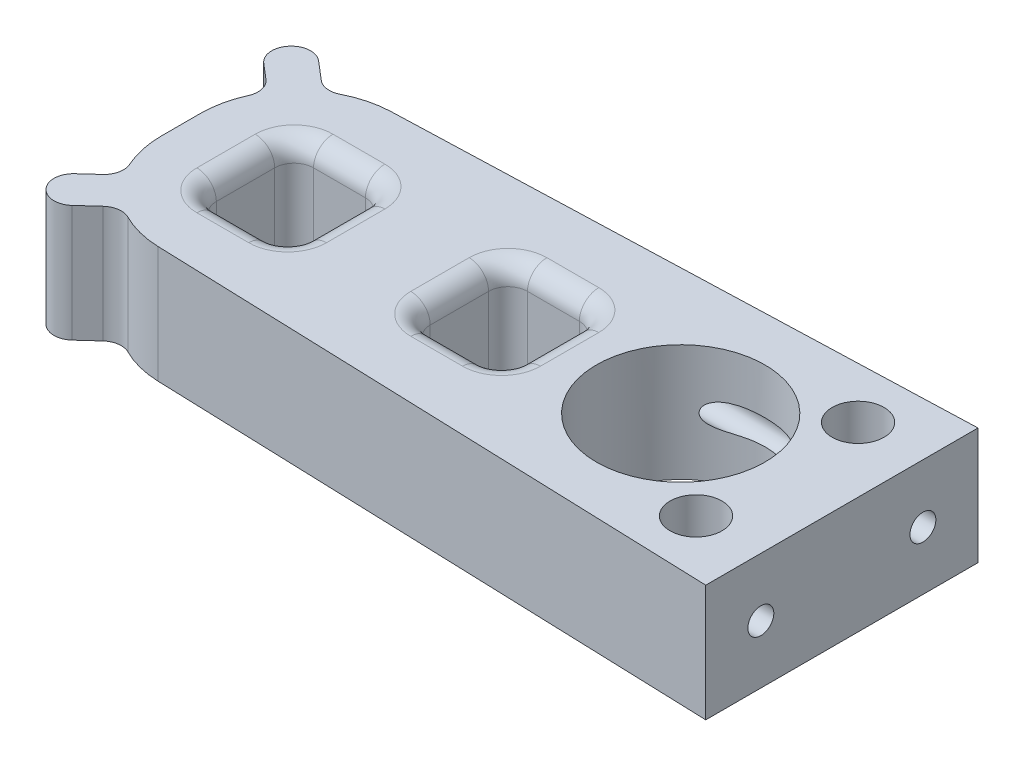
from build123d import *

# Parameters (mm, degrees)
SKETCH1_W           = 14
SKETCH1_H           = 15
BOSS_EXTRUDE1_DEPTH = 18
FILLET1_R           = 15
FILLET2_R           = 3
SKETCH2_R           = 2
CUT_EXTRUDE1_DEPTH  = 50
SKETCH3_R           = 4
SKETCH3_R_2         = 13
CUT_EXTRUDE2_DEPTH  = 15
SKETCH4_R           = 13
CUT_EXTRUDE3_DEPTH  = 17
BOSS_EXTRUDE2_DEPTH = 18
FILLET3_R           = 3


with BuildPart() as part:
    # Sketch1 → Boss-Extrude1 (new body)
    with BuildSketch(Plane(origin=(0, 0, 0), x_dir=(1, 0, 0), z_dir=(0, 1, 0))):
        Polygon((-17, 17.5), (85, 21), (85, 9.107228482), (85, -21), (-17, -17.5), align=None)
        with Locations((33, 0)):
            Rectangle(SKETCH1_W, SKETCH1_H, mode=Mode.SUBTRACT)
        Rectangle(SKETCH1_W, SKETCH1_H, mode=Mode.SUBTRACT)
    extrude(amount=BOSS_EXTRUDE1_DEPTH)

    # Fillet1
    fillet1_edges = [part.edges().sort_by_distance(p)[0] for p in [
        (-17, 9, -17.5),
        (-17, 9, 17.5),
    ]]
    fillet(fillet1_edges, radius=FILLET1_R)

    # Fillet2
    fillet2_edges = [part.edges().sort_by_distance(p)[0] for p in [
        (40, 0, 0),
        (40, 9, 7.5),
        (33, 0, -7.5),
        (40, 9, -7.5),
        (26, 0, 0),
        (26, 9, -7.5),
        (33, 0, 7.5),
        (26, 9, 7.5),
        (40, 18, 0),
        (33, 18, -7.5),
        (26, 18, 0),
        (33, 18, 7.5),
        (0, 0, 7.5),
        (-7, 9, 7.5),
        (7, 0, 0),
        (7, 9, 7.5),
        (0, 0, -7.5),
        (7, 9, -7.5),
        (-7, 0, 0),
        (-7, 9, -7.5),
        (0, 18, 7.5),
        (7, 18, 0),
        (0, 18, -7.5),
        (-7, 18, 0),
    ]]
    fillet(fillet2_edges, radius=FILLET2_R)

    # Sketch2 → Cut-Extrude1 (cut)
    with BuildSketch(Plane(origin=(85, 0, 0), x_dir=(0, 0, -1), z_dir=(1, 0, 0))):
        with Locations((-12.5, 9)):
            Circle(SKETCH2_R)
        with Locations((12.5, 9)):
            Circle(SKETCH2_R)
    extrude(amount=-CUT_EXTRUDE1_DEPTH, mode=Mode.SUBTRACT)

    # Sketch3 → Cut-Extrude2 (cut)
    with BuildSketch(Plane(origin=(0, 18, 0), x_dir=(1, 0, 0), z_dir=(0, 1, 0))):
        with Locations(Location((75, -12.5, 0), (0, 0, 270))):
            Circle(SKETCH3_R)
        with Locations(Location((75, 12.5, 0), (0, 0, 270))):
            Circle(SKETCH3_R)
        with Locations(Location((60.134936776, 0, 0), (0, 0, 270))):
            Circle(SKETCH3_R_2)
    extrude(amount=-CUT_EXTRUDE2_DEPTH, mode=Mode.SUBTRACT)

    # Sketch4 → Cut-Extrude3 (cut)
    with BuildSketch(Plane(origin=(0, 3, 0), x_dir=(1, 0, 0), z_dir=(0, 1, 0))):
        with Locations(Location((60.134936776, 0, 0), (0, 0, 270))):
            Circle(SKETCH4_R)
    extrude(amount=-CUT_EXTRUDE3_DEPTH, mode=Mode.SUBTRACT)

    # Sketch5 → Boss-Extrude2 (add)
    with BuildSketch(Plane(origin=(0, 18, 0), x_dir=(1, 0, 0), z_dir=(0, 1, 0))):
        with BuildLine():
            Line((-18.63945701, -14.697303528), (-14.805649864, -11.209834681))
            ThreePointArc((-14.805649864, -11.209834681), (-10.567748383, -11.410311701), (-10.768225403, -15.648213182))
            Line((-10.768225403, -15.648213182), (-14.602032549, -19.135682029))
            ThreePointArc((-14.602032549, -19.135682029), (-18.83993403, -18.935205009), (-18.63945701, -14.697303528))
        make_face()
        with BuildLine():
            Line((-14.922114484, 19.198776677), (-10.838309795, 15.709999501))
            ThreePointArc((-10.838309795, 15.709999501), (-10.505962064, 11.480396093), (-14.735565472, 11.148048363))
            Line((-14.735565472, 11.148048363), (-18.819370162, 14.636825539))
            ThreePointArc((-18.819370162, 14.636825539), (-19.151717892, 18.866428947), (-14.922114484, 19.198776677))
        make_face()
    extrude(amount=-BOSS_EXTRUDE2_DEPTH)

    # Fillet3
    fillet3_edges = [part.edges().sort_by_distance(p)[0] for p in [
        (-10.497018978, 9, -15.367134494),
        (-14.645378783, 9, -11.073987522),
        (-14.645378783, 9, 11.073987522),
        (-10.497018978, 9, 15.367134494),
    ]]
    fillet(fillet3_edges, radius=FILLET3_R)


solid = part.part
